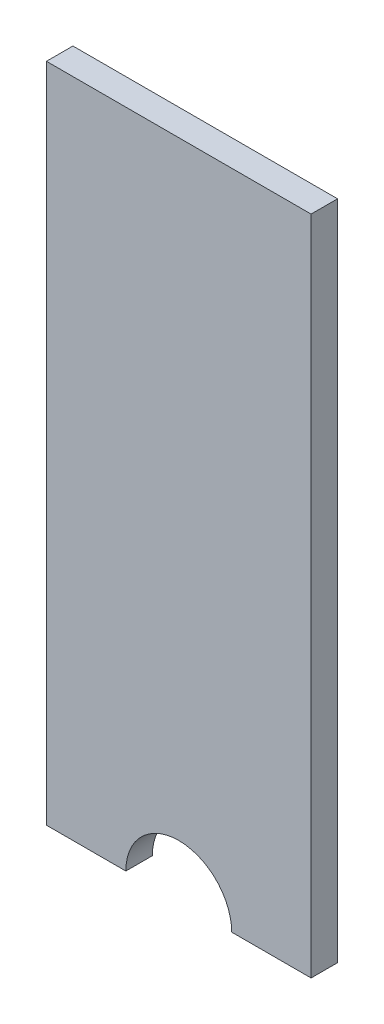
from build123d import *

# Parameters (mm, degrees)
SKETCH1_W           = 200
SKETCH1_H           = 500
BOSS_EXTRUDE1_DEPTH = 20
SKETCH2_R           = 40
CUT_EXTRUDE1_DEPTH  = 68


with BuildPart() as part:
    # Sketch1 → Boss-Extrude1 (new body)
    with BuildSketch(Plane.XY):
        with Locations((-61.414597136, 90.395332254)):
            Rectangle(SKETCH1_W, SKETCH1_H)
    extrude(amount=BOSS_EXTRUDE1_DEPTH)

    # Sketch2 → Cut-Extrude1 (cut)
    with BuildSketch(Plane.XY.offset(20)):
        with Locations((-61.414597136, -159.604667746)):
            Circle(SKETCH2_R)
    extrude(amount=-CUT_EXTRUDE1_DEPTH, mode=Mode.SUBTRACT)


solid = part.part
